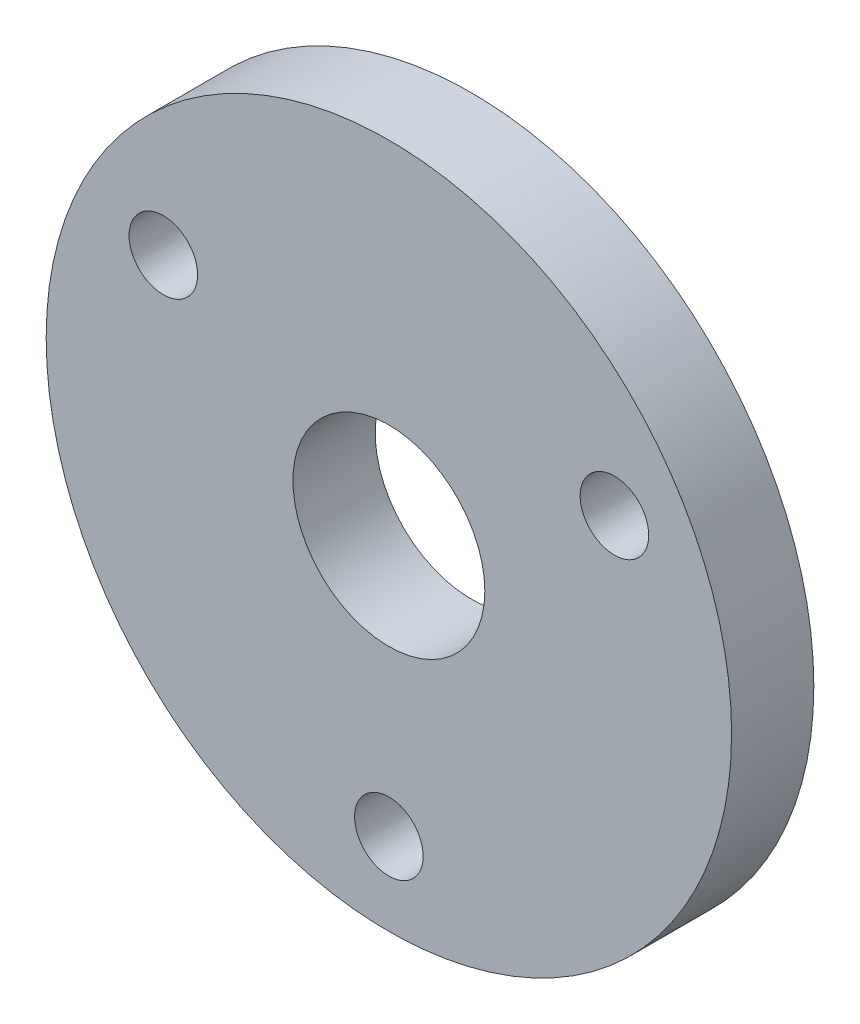
from build123d import *

# Parameters (mm, degrees)
SKETCH1_R           = 25
SKETCH1_R_2         = 7
SKETCH1_R_3         = 2.5
BOSS_EXTRUDE1_DEPTH = 6


with BuildPart() as part:
    # Sketch1 → Boss-Extrude1 (new body)
    with BuildSketch(Plane.XY):
        Circle(SKETCH1_R)
        Circle(SKETCH1_R_2, mode=Mode.SUBTRACT)
        with Locations((0, -19)):
            Circle(SKETCH1_R_3, mode=Mode.SUBTRACT)
        with Locations((-16.454482672, 9.5)):
            Circle(SKETCH1_R_3, mode=Mode.SUBTRACT)
        with Locations((16.454482672, 9.5)):
            Circle(SKETCH1_R_3, mode=Mode.SUBTRACT)
    extrude(amount=BOSS_EXTRUDE1_DEPTH)


solid = part.part
